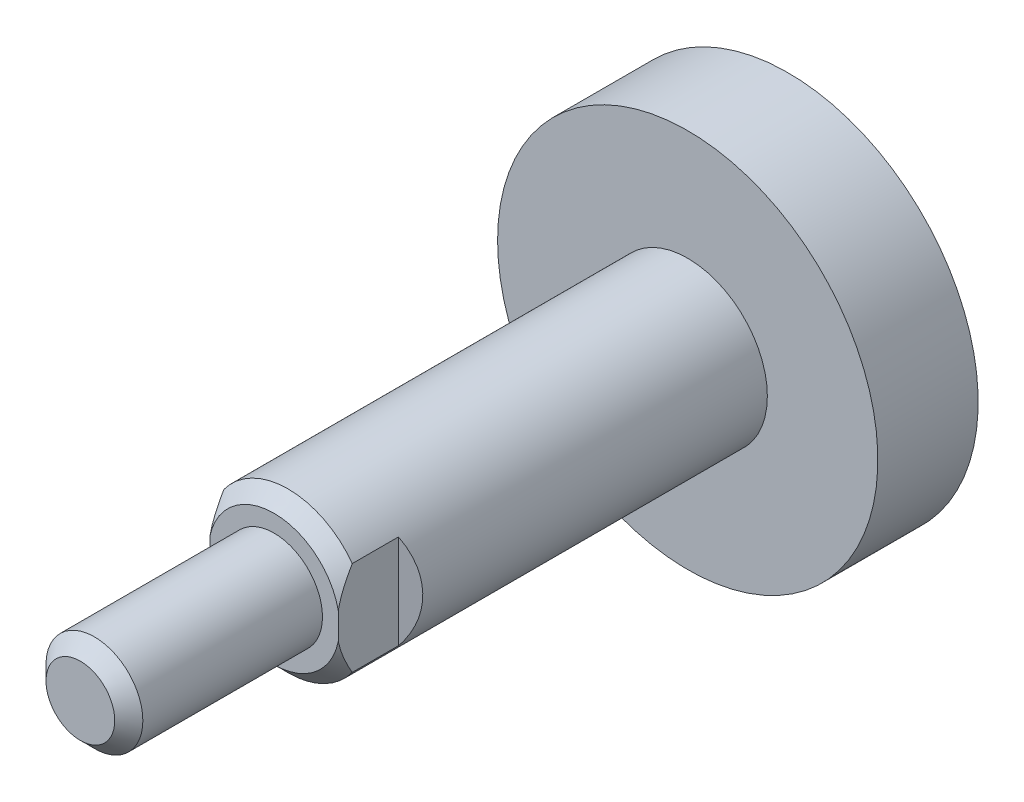
from build123d import *

# Parameters (mm, degrees)
SKETCH1_W           = 9.475
SKETCH1_H           = 5
SKETCH2_R           = 3.969
BOSS_EXTRUDE1_DEPTH = 20.614
CUT_EXTRUDE1_REACH  = 30.907
CUT_EXTRUDE2_REACH  = 30.907
SKETCH7_R           = 2.413
BOSS_EXTRUDE2_DEPTH = 9.652
CHAMFER1_SIZE       = 0.7


with BuildPart() as part:
    # Sketch1 → Revolve1 (revolve)
    with BuildSketch(Plane.XZ, mode=Mode.PRIVATE) as revolve1_sk:
        with Locations((4.7375, 2.5)):
            Rectangle(SKETCH1_W, SKETCH1_H)
    revolve(revolve1_sk.sketch.rotate(Axis((0, 0, 5), (0, 0, -1)), 180), axis=Axis((0, 0, 5), (0, 0, -1)))

    # Sketch2 → Boss-Extrude1 (add)
    with BuildSketch(Plane.XY.offset(5)):
        Circle(SKETCH2_R)
    extrude(amount=BOSS_EXTRUDE1_DEPTH)

    # Cut-Extrude1: up to this plane
    cut_extrude1_end = Plane(origin=(10.592149241, 0, 18.346140646), z_dir=(-0.5000000000000046, 0, -0.8660254037844362))
    # Sketch4 → Cut-Extrude1 (cut, up to the surface)
    with BuildSketch(Plane.XY.offset(25.614), mode=Mode.PRIVATE) as cut_extrude1_sk1:
        with BuildLine():
            Line((3.2, 2.347969548), (3.2, -2.347969548))
            ThreePointArc((3.2, -2.347969548), (3.969, 0), (3.2, 2.347969548))
        make_face()
    cut_extrude1_tool1 = split(extrude(cut_extrude1_sk1.sketch, amount=-CUT_EXTRUDE1_REACH, mode=Mode.PRIVATE), bisect_by=cut_extrude1_end, keep=Keep.BOTH, mode=Mode.PRIVATE)
    add(cut_extrude1_tool1.solids().sort_by_distance((3.510306, 0, 25.614))[0], mode=Mode.SUBTRACT)

    # Cut-Extrude2: up to this plane
    cut_extrude2_end = Plane(origin=(-10.592149241, 0, 18.346140646), z_dir=(0.500000000000003, 0, -0.8660254037844369))
    # Sketch6 → Cut-Extrude2 (cut, up to the surface)
    with BuildSketch(Plane.XY.offset(25.614), mode=Mode.PRIVATE) as cut_extrude2_sk1:
        with BuildLine():
            Line((-3.2, -2.347969548), (-3.2, 2.347969548))
            ThreePointArc((-3.2, 2.347969548), (-3.969, 0), (-3.2, -2.347969548))
        make_face()
    cut_extrude2_tool1 = split(extrude(cut_extrude2_sk1.sketch, amount=-CUT_EXTRUDE2_REACH, mode=Mode.PRIVATE), bisect_by=cut_extrude2_end, keep=Keep.BOTH, mode=Mode.PRIVATE)
    add(cut_extrude2_tool1.solids().sort_by_distance((-3.510306, 0, 25.614))[0], mode=Mode.SUBTRACT)

    # Sketch7 → Boss-Extrude2 (add)
    with BuildSketch(Plane.XY.offset(25.614)):
        Circle(SKETCH7_R)
    extrude(amount=BOSS_EXTRUDE2_DEPTH)

    # Chamfer1
    chamfer1_edges = [part.edges().sort_by_distance(p)[0] for p in [
        (0, -3.969, 25.614),
        (-2.413, 0, 35.266),
        (0, 3.969, 25.614),
    ]]
    chamfer(chamfer1_edges, length=CHAMFER1_SIZE)


solid = part.part
